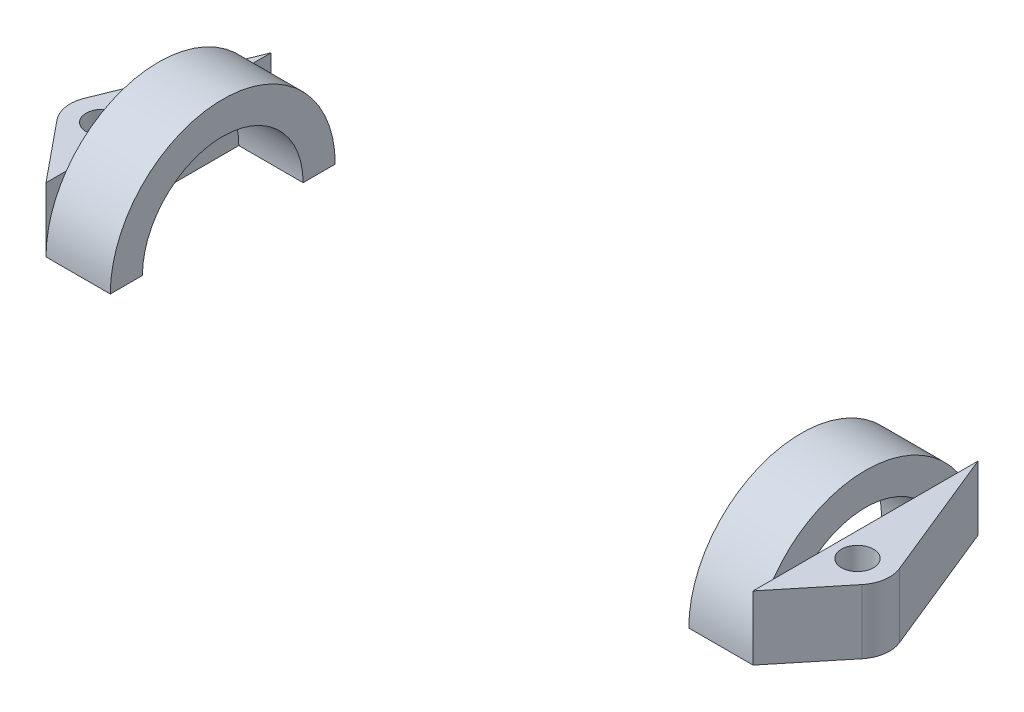
from build123d import *

# Parameters (mm, degrees)
BOSS_EXTRUDE1_DEPTH = 22
SKETCH6_R           = 0.5
BOSS_EXTRUDE4_DEPTH = 2
SKETCH3_W           = 18
SKETCH3_H           = 10
CUT_EXTRUDE1_DEPTH  = 25.260307088


with BuildPart() as part:
    # Sketch1 → Boss-Extrude1 (new body)
    with BuildSketch(Plane(origin=(0, 0, 0), x_dir=(0, 0, -1), z_dir=(1, 0, 0))):
        with BuildLine():
            Line((2.5, 0), (3.5, 0))
            ThreePointArc((3.5, 0), (0, 3.5), (-3.5, 0))
            Line((-3.5, 0), (-2.5, 0))
            ThreePointArc((-2.5, 0), (0, 2.5), (2.5, 0))
        make_face()
    extrude(amount=BOSS_EXTRUDE1_DEPTH)

    # Sketch6 → Boss-Extrude4 (add)
    # profile 1 of 2: a face of its own
    with BuildSketch(Plane(origin=(0, 0, 0), x_dir=(1, 0, 0), z_dir=(0, 1, 0))):
        with BuildLine():
            Line((0, -3.5), (-1.524646859, -1.632394058))
            ThreePointArc((-1.524646859, -1.632394058), (-1.73888302, -1.14869557), (-1.676369035, -0.623382939))
            Line((-1.676369035, -0.623382939), (0, 3.5))
            Line((0, 3.5), (0, -3.5))
        make_face()
        with Locations(Location((-0.75, -1, 0), (0, 0, 270))):
            Circle(SKETCH6_R, mode=Mode.SUBTRACT)
    # profile 2 of 2: a face of its own
    with BuildSketch(Plane(origin=(0, 0, 0), x_dir=(1, 0, 0), z_dir=(0, 1, 0))):
        with BuildLine():
            Line((22, 3.5), (23.676369035, -0.623382939))
            ThreePointArc((23.676369035, -0.623382939), (23.73888302, -1.14869557), (23.524646859, -1.632394058))
            Line((23.524646859, -1.632394058), (22, -3.5))
            Line((22, -3.5), (22, 3.5))
        make_face()
        with Locations(Location((22.75, -1, 0), (0, 0, 90))):
            Circle(SKETCH6_R, mode=Mode.SUBTRACT)
    extrude(amount=BOSS_EXTRUDE4_DEPTH)

    # Sketch3 → Cut-Extrude1 (cut, through all)
    with BuildSketch(Plane.XZ):
        with Locations((11, 0)):
            Rectangle(SKETCH3_W, SKETCH3_H)
    extrude(amount=-CUT_EXTRUDE1_DEPTH, mode=Mode.SUBTRACT)


with BuildPart() as cut_extrude1_piece_1:
    # of the separate pieces the step leaves, piece 1, a body of its own (cut_extrude1_pieces)
    add(part.part.solids().sort_by_distance((20, 0, -2.5))[0])


with BuildPart() as cut_extrude1_piece_2:
    # of the separate pieces the step leaves, piece 2, a body of its own (cut_extrude1_pieces)
    add(part.part.solids().sort_by_distance((0, 0, -2.5))[0])


solid = Compound([cut_extrude1_piece_1.part, cut_extrude1_piece_2.part])
